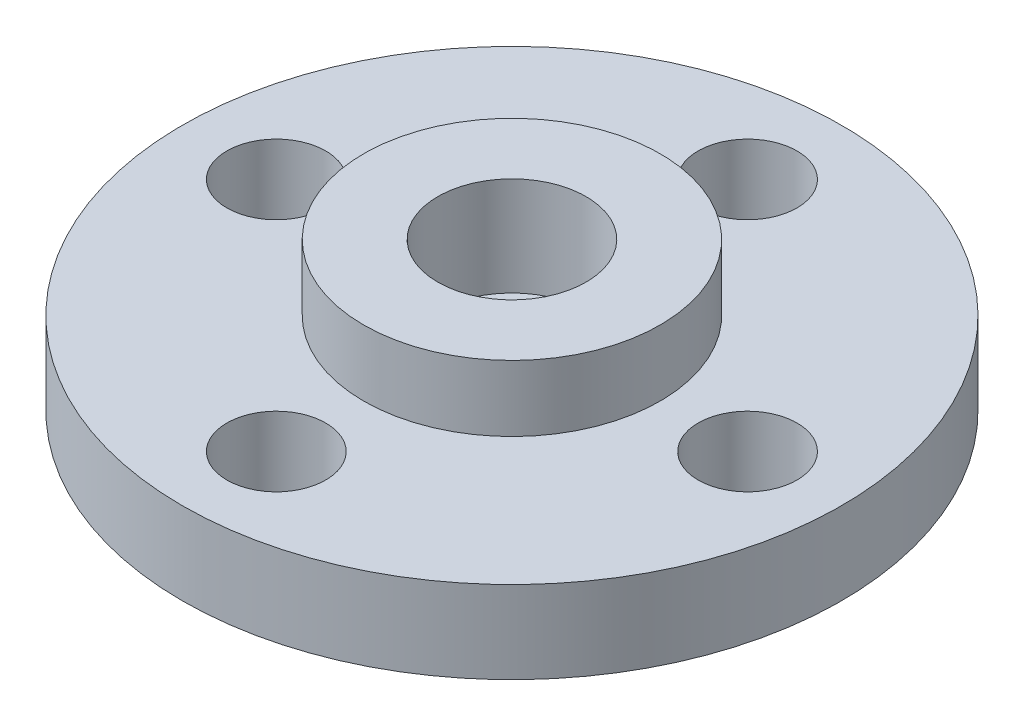
from build123d import *

# Parameters (mm, degrees)
SKETCH1_R           = 10
SKETCH1_R_2         = 1.5
BOSS_EXTRUDE1_DEPTH = 2.5
SKETCH2_R           = 4.5
BOSS_EXTRUDE2_DEPTH = 2
SKETCH3_R           = 2.25
CUT_EXTRUDE1_DEPTH  = 3


with BuildPart() as part:
    # Sketch1 → Boss-Extrude1 (new body)
    with BuildSketch(Plane(origin=(0, 0, 0), x_dir=(1, 0, 0), z_dir=(0, 1, 0))):
        with Locations(Location((0, 0, 0), (0, 0, 270))):
            Circle(SKETCH1_R)
        with Locations(Location((0, 0, 0), (0, 0, 270))):
            Circle(SKETCH1_R_2, mode=Mode.SUBTRACT)
        with Locations(Location((0, 7.15, 0), (0, 0, 270))):
            Circle(SKETCH1_R_2, mode=Mode.SUBTRACT)
        with Locations(Location((7.15, 0, 0), (0, 0, 270))):
            Circle(SKETCH1_R_2, mode=Mode.SUBTRACT)
        with Locations(Location((0, -7.15, 0), (0, 0, 270))):
            Circle(SKETCH1_R_2, mode=Mode.SUBTRACT)
        with Locations(Location((-7.15, 0, 0), (0, 0, 270))):
            Circle(SKETCH1_R_2, mode=Mode.SUBTRACT)
    extrude(amount=BOSS_EXTRUDE1_DEPTH)

    # Sketch2 → Boss-Extrude2 (add)
    with BuildSketch(Plane(origin=(0, 2.5, 0), x_dir=(1, 0, 0), z_dir=(0, 1, 0))):
        with Locations(Location((0, 0, 0), (0, 0, 270))):
            Circle(SKETCH2_R)
    extrude(amount=BOSS_EXTRUDE2_DEPTH)

    # Sketch3 → Cut-Extrude1 (cut)
    with BuildSketch(Plane(origin=(0, 4.5, 0), x_dir=(1, 0, 0), z_dir=(0, 1, 0))):
        with Locations(Location((0, 0, 0), (0, 0, 270))):
            Circle(SKETCH3_R)
    extrude(amount=-CUT_EXTRUDE1_DEPTH, mode=Mode.SUBTRACT)


solid = part.part
